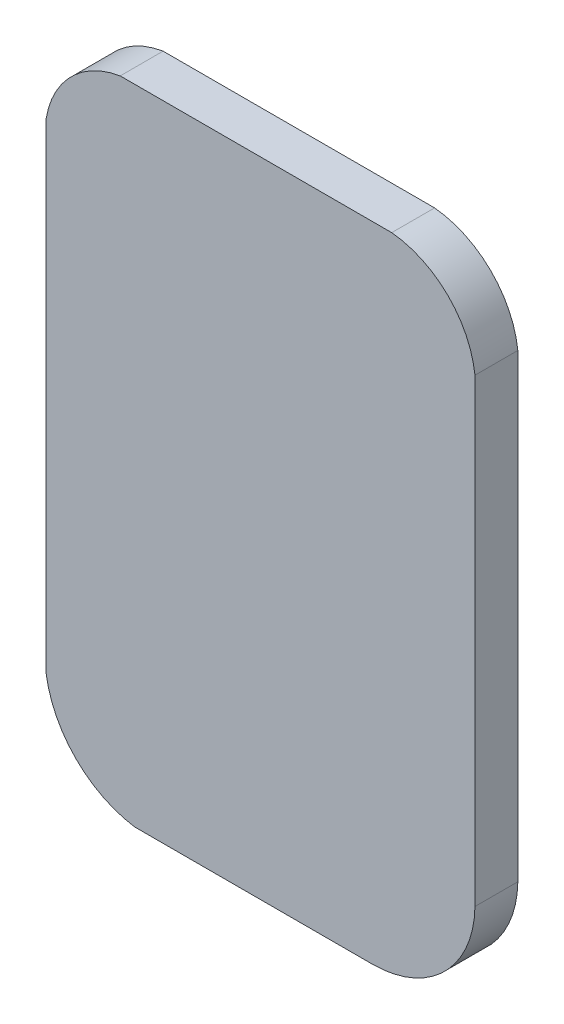
from build123d import *

# Parameters (mm, degrees)
BOSS_EXTRUDE1_DEPTH = 120


with BuildPart() as part:
    # Sketch3 → Boss-Extrude1 (new body)
    with BuildSketch(Plane.XY):
        with BuildLine():
            Line((367.047667182, 900), (-392.766729868, 900))
            ThreePointArc((-392.766729868, 900), (-529.765209749, 829.765209749), (-600, 692.766729868))
            Line((-600, 692.766729868), (-600, -652.262218358))
            ThreePointArc((-600, -652.262218358), (-516.83040869, -816.83040869), (-352.262218358, -900))
            Line((-352.262218358, -900), (316.675693069, -900))
            ThreePointArc((316.675693069, -900), (515.76634783, -815.76634783), (600, -616.675693069))
            Line((600, -616.675693069), (600, -607.982402727))
            Line((600, -607.982402727), (600, 671.022296826))
            ThreePointArc((600, 671.022296826), (524.004104789, 826.694082288), (367.047667182, 900))
        make_face()
    extrude(amount=BOSS_EXTRUDE1_DEPTH)


solid = part.part
